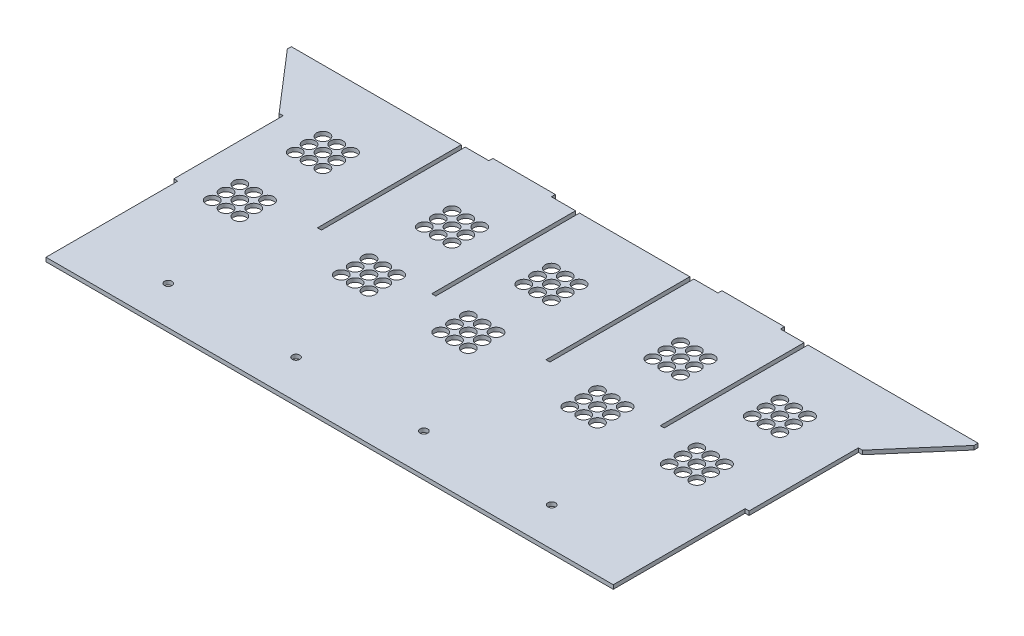
from build123d import *

# Parameters (mm, degrees)
SKETCH1_W                   = 457.2020066
SKETCH1_H                   = 3.175
BOSS_EXTRUDE1_DEPTH         = 242.425000036
SKETCH2_W                   = 3.175
SKETCH2_H                   = 114.3
CUT_EXTRUDE1_DEPTH          = 334.224218774
LPATTERN1_COUNT             = 4
LPATTERN1_PITCH             = 90.807
BOSS_EXTRUDE3_DEPTH         = 3.175
SKETCH5_W                   = 3.175
SKETCH5_H                   = 104.775
CUT_EXTRUDE2_DEPTH          = 3.175
SKETCH32_R                  = 3
CUT_EXTRUDE9_DEPTH          = 366.022293079
LPATTERN24_COUNT            = 4
LPATTERN24_PITCH            = 101.6
SKETCH34_R                  = 5
CUT_EXTRUDE10_DEPTH         = 366.022293079
LPATTERN25_COUNT            = 3
LPATTERN25_PITCH            = 11
LPATTERN26_COUNT            = 3
LPATTERN26_PITCH            = 11
LPATTERN26_COPY_1_SKETCH_R  = 5
LPATTERN26_COPY_1_DEPTH     = 366.022293079
LPATTERN26_COPY_2_SKETCH_R  = 5
LPATTERN26_COPY_2_DEPTH     = 366.022293079
LPATTERN26_COPY_3_SKETCH_R  = 5
LPATTERN26_COPY_3_DEPTH     = 366.022293079
LPATTERN26_COPY_4_SKETCH_R  = 5
LPATTERN26_COPY_4_DEPTH     = 366.022293079
LPATTERN27_COUNT            = 3
LPATTERN27_PITCH            = 181.6
LPATTERN27_COPY_1_SKETCH_R  = 5
LPATTERN27_COPY_1_DEPTH     = 366.022293079
LPATTERN27_COPY_2_SKETCH_R  = 5
LPATTERN27_COPY_2_DEPTH     = 366.022293079
LPATTERN27_COPY_3_SKETCH_R  = 5
LPATTERN27_COPY_3_DEPTH     = 366.022293079
LPATTERN27_COPY_4_SKETCH_R  = 5
LPATTERN27_COPY_4_DEPTH     = 366.022293079
LPATTERN27_COPY_5_SKETCH_R  = 5
LPATTERN27_COPY_5_DEPTH     = 366.022293079
LPATTERN27_COPY_6_SKETCH_R  = 5
LPATTERN27_COPY_6_DEPTH     = 366.022293079
LPATTERN27_COPY_7_SKETCH_R  = 5
LPATTERN27_COPY_7_DEPTH     = 366.022293079
LPATTERN27_COPY_8_SKETCH_R  = 5
LPATTERN27_COPY_8_DEPTH     = 366.022293079
LPATTERN27_COPY_9_SKETCH_R  = 5
LPATTERN27_COPY_9_DEPTH     = 366.022293079
LPATTERN27_COPY_10_SKETCH_R = 5
LPATTERN27_COPY_10_DEPTH    = 366.022293079
LPATTERN27_COPY_11_SKETCH_R = 5
LPATTERN27_COPY_11_DEPTH    = 366.022293079
LPATTERN27_COPY_12_SKETCH_R = 5
LPATTERN27_COPY_12_DEPTH    = 366.022293079
LPATTERN27_COPY_13_SKETCH_R = 5
LPATTERN27_COPY_13_DEPTH    = 366.022293079
LPATTERN27_COPY_14_SKETCH_R = 5
LPATTERN27_COPY_14_DEPTH    = 366.022293079
LPATTERN27_COPY_15_SKETCH_R = 5
LPATTERN27_COPY_15_DEPTH    = 366.022293079
LPATTERN27_COPY_16_SKETCH_R = 5
LPATTERN27_COPY_16_DEPTH    = 366.022293079
SKETCH35_R                  = 5
CUT_EXTRUDE11_DEPTH         = 366.022293079
LPATTERN28_COUNT            = 3
LPATTERN28_PITCH            = 11
LPATTERN29_COUNT            = 3
LPATTERN29_PITCH            = 11
LPATTERN29_COPY_1_SKETCH_R  = 5
LPATTERN29_COPY_1_DEPTH     = 366.022293079
LPATTERN29_COPY_2_SKETCH_R  = 5
LPATTERN29_COPY_2_DEPTH     = 366.022293079
LPATTERN29_COPY_3_SKETCH_R  = 5
LPATTERN29_COPY_3_DEPTH     = 366.022293079
LPATTERN29_COPY_4_SKETCH_R  = 5
LPATTERN29_COPY_4_DEPTH     = 366.022293079
LPATTERN30_COUNT            = 2
LPATTERN30_PITCH            = 181.6
LPATTERN30_COPY_1_SKETCH_R  = 5
LPATTERN30_COPY_1_DEPTH     = 366.022293079
LPATTERN30_COPY_2_SKETCH_R  = 5
LPATTERN30_COPY_2_DEPTH     = 366.022293079
LPATTERN30_COPY_3_SKETCH_R  = 5
LPATTERN30_COPY_3_DEPTH     = 366.022293079
LPATTERN30_COPY_4_SKETCH_R  = 5
LPATTERN30_COPY_4_DEPTH     = 366.022293079
LPATTERN30_COPY_5_SKETCH_R  = 5
LPATTERN30_COPY_5_DEPTH     = 366.022293079
LPATTERN30_COPY_6_SKETCH_R  = 5
LPATTERN30_COPY_6_DEPTH     = 366.022293079
LPATTERN30_COPY_7_SKETCH_R  = 5
LPATTERN30_COPY_7_DEPTH     = 366.022293079
LPATTERN30_COPY_8_SKETCH_R  = 5
LPATTERN30_COPY_8_DEPTH     = 366.022293079
SKETCH36_W                  = 49.658811606
SKETCH36_H                  = 3.175
BOSS_EXTRUDE4_DEPTH         = 3.175


with BuildPart() as part:
    # Sketch1 → Boss-Extrude1 (new body)
    with BuildSketch(Plane.XY):
        Rectangle(SKETCH1_W, SKETCH1_H)
    extrude(amount=BOSS_EXTRUDE1_DEPTH)

    # Sketch2 → Cut-Extrude1 (cut, through all)
    with BuildSketch(Plane(origin=(0, 1.5875, 0), x_dir=(1, 0, 0), z_dir=(0, 1, 0))):
        with Locations((136.2085033, -57.15)):
            Rectangle(SKETCH2_W, SKETCH2_H)
    cut_extrude1 = extrude(amount=-CUT_EXTRUDE1_DEPTH, mode=Mode.SUBTRACT)

    # LPattern1: Cut-Extrude1 ×4
    with Locations(*[(-i * LPATTERN1_PITCH, 0, 0) for i in range(1, LPATTERN1_COUNT)]):
        add(cut_extrude1, mode=Mode.SUBTRACT)

    # Sketch4 → Boss-Extrude3 (add)
    with BuildSketch(Plane.XZ.offset(1.5875)):
        Polygon((-228.6010033, 0), (-272.8760033, 0), (-272.8760033, 3.175), (-231.7760033, 50.8), (-228.6010033, 50.8), align=None)
    boss_extrude3 = extrude(amount=-BOSS_EXTRUDE3_DEPTH)

    # Mirror1: Boss-Extrude3 across plane
    add(boss_extrude3.mirror(Plane(origin=(0, 0, 0), x_dir=(0, 0, 1), z_dir=(1, 0, 0))))

    # Sketch5 → Cut-Extrude2 (cut)
    with BuildSketch(Plane.XZ.offset(1.5875)):
        with Locations((-227.0135033, 190.037500036)):
            Rectangle(SKETCH5_W, SKETCH5_H)
    cut_extrude2 = extrude(amount=-CUT_EXTRUDE2_DEPTH, mode=Mode.SUBTRACT)

    # Mirror2: Cut-Extrude2 across plane
    add(cut_extrude2.mirror(Plane(origin=(0, 0, 0), x_dir=(0, 0, 1), z_dir=(1, 0, 0))), mode=Mode.SUBTRACT)

    # Sketch32 → Cut-Extrude9 (cut, through all)
    with BuildSketch(Plane.XZ.offset(1.5875)):
        with Locations(Location((145.971441249, 211.879970101, 0), (0, 0, 270))):
            Circle(SKETCH32_R)
    cut_extrude9 = extrude(amount=-CUT_EXTRUDE9_DEPTH, mode=Mode.SUBTRACT)

    # LPattern24: Cut-Extrude9 ×4
    with Locations(*[(-i * LPATTERN24_PITCH, 0, 0) for i in range(1, LPATTERN24_COUNT)]):
        add(cut_extrude9, mode=Mode.SUBTRACT)

    # Sketch34 → Cut-Extrude10 (cut, through all)
    with BuildSketch(Plane(origin=(0, 1.5875, 0), x_dir=(1, 0, 0), z_dir=(0, 1, 0))):
        with Locations(Location((-198.515375, -49.256662939, 0), (0, 0, 270))):
            Circle(SKETCH34_R)
        with Locations(Location((-198.515375, -115.256662939, 0), (0, 0, 270))):
            Circle(SKETCH34_R)
    cut_extrude10 = extrude(amount=-CUT_EXTRUDE10_DEPTH, mode=Mode.SUBTRACT)

    # LPattern25: Cut-Extrude10 ×3
    with Locations(*[(i * LPATTERN25_PITCH, 0, 0) for i in range(1, LPATTERN25_COUNT)]):
        add(cut_extrude10, mode=Mode.SUBTRACT)

    # LPattern26: Cut-Extrude10 ×3
    with Locations(*[(0, 0, i * LPATTERN26_PITCH) for i in range(1, LPATTERN26_COUNT)]):
        add(cut_extrude10, mode=Mode.SUBTRACT)

    # LPattern26 copy 1 sketch → LPattern26 copy 1 (cut, through all)
    with BuildSketch(Plane(origin=(11, 1.5875, 11), x_dir=(1, 0, 0), z_dir=(0, 1, 0))):
        with Locations(Location((-198.515375, -49.256662939, 0), (0, 0, 270))):
            Circle(LPATTERN26_COPY_1_SKETCH_R)
        with Locations(Location((-198.515375, -115.256662939, 0), (0, 0, 270))):
            Circle(LPATTERN26_COPY_1_SKETCH_R)
    extrude(amount=-LPATTERN26_COPY_1_DEPTH, mode=Mode.SUBTRACT)

    # LPattern26 copy 2 sketch → LPattern26 copy 2 (cut, through all)
    with BuildSketch(Plane(origin=(11, 1.5875, 22), x_dir=(1, 0, 0), z_dir=(0, 1, 0))):
        with Locations(Location((-198.515375, -49.256662939, 0), (0, 0, 270))):
            Circle(LPATTERN26_COPY_2_SKETCH_R)
        with Locations(Location((-198.515375, -115.256662939, 0), (0, 0, 270))):
            Circle(LPATTERN26_COPY_2_SKETCH_R)
    extrude(amount=-LPATTERN26_COPY_2_DEPTH, mode=Mode.SUBTRACT)

    # LPattern26 copy 3 sketch → LPattern26 copy 3 (cut, through all)
    with BuildSketch(Plane(origin=(22, 1.5875, 11), x_dir=(1, 0, 0), z_dir=(0, 1, 0))):
        with Locations(Location((-198.515375, -49.256662939, 0), (0, 0, 270))):
            Circle(LPATTERN26_COPY_3_SKETCH_R)
        with Locations(Location((-198.515375, -115.256662939, 0), (0, 0, 270))):
            Circle(LPATTERN26_COPY_3_SKETCH_R)
    extrude(amount=-LPATTERN26_COPY_3_DEPTH, mode=Mode.SUBTRACT)

    # LPattern26 copy 4 sketch → LPattern26 copy 4 (cut, through all)
    with BuildSketch(Plane(origin=(22, 1.5875, 22), x_dir=(1, 0, 0), z_dir=(0, 1, 0))):
        with Locations(Location((-198.515375, -49.256662939, 0), (0, 0, 270))):
            Circle(LPATTERN26_COPY_4_SKETCH_R)
        with Locations(Location((-198.515375, -115.256662939, 0), (0, 0, 270))):
            Circle(LPATTERN26_COPY_4_SKETCH_R)
    extrude(amount=-LPATTERN26_COPY_4_DEPTH, mode=Mode.SUBTRACT)

    # LPattern27: Cut-Extrude10 ×3
    with Locations(*[(i * LPATTERN27_PITCH, 0, 0) for i in range(1, LPATTERN27_COUNT)]):
        add(cut_extrude10, mode=Mode.SUBTRACT)

    # LPattern27 copy 1 sketch → LPattern27 copy 1 (cut, through all)
    with BuildSketch(Plane(origin=(192.6, 1.5875, 0), x_dir=(1, 0, 0), z_dir=(0, 1, 0))):
        with Locations(Location((-198.515375, -49.256662939, 0), (0, 0, 270))):
            Circle(LPATTERN27_COPY_1_SKETCH_R)
        with Locations(Location((-198.515375, -115.256662939, 0), (0, 0, 270))):
            Circle(LPATTERN27_COPY_1_SKETCH_R)
    extrude(amount=-LPATTERN27_COPY_1_DEPTH, mode=Mode.SUBTRACT)

    # LPattern27 copy 2 sketch → LPattern27 copy 2 (cut, through all)
    with BuildSketch(Plane(origin=(374.2, 1.5875, 0), x_dir=(1, 0, 0), z_dir=(0, 1, 0))):
        with Locations(Location((-198.515375, -49.256662939, 0), (0, 0, 270))):
            Circle(LPATTERN27_COPY_2_SKETCH_R)
        with Locations(Location((-198.515375, -115.256662939, 0), (0, 0, 270))):
            Circle(LPATTERN27_COPY_2_SKETCH_R)
    extrude(amount=-LPATTERN27_COPY_2_DEPTH, mode=Mode.SUBTRACT)

    # LPattern27 copy 3 sketch → LPattern27 copy 3 (cut, through all)
    with BuildSketch(Plane(origin=(203.6, 1.5875, 0), x_dir=(1, 0, 0), z_dir=(0, 1, 0))):
        with Locations(Location((-198.515375, -49.256662939, 0), (0, 0, 270))):
            Circle(LPATTERN27_COPY_3_SKETCH_R)
        with Locations(Location((-198.515375, -115.256662939, 0), (0, 0, 270))):
            Circle(LPATTERN27_COPY_3_SKETCH_R)
    extrude(amount=-LPATTERN27_COPY_3_DEPTH, mode=Mode.SUBTRACT)

    # LPattern27 copy 4 sketch → LPattern27 copy 4 (cut, through all)
    with BuildSketch(Plane(origin=(385.2, 1.5875, 0), x_dir=(1, 0, 0), z_dir=(0, 1, 0))):
        with Locations(Location((-198.515375, -49.256662939, 0), (0, 0, 270))):
            Circle(LPATTERN27_COPY_4_SKETCH_R)
        with Locations(Location((-198.515375, -115.256662939, 0), (0, 0, 270))):
            Circle(LPATTERN27_COPY_4_SKETCH_R)
    extrude(amount=-LPATTERN27_COPY_4_DEPTH, mode=Mode.SUBTRACT)

    # LPattern27 copy 5 sketch → LPattern27 copy 5 (cut, through all)
    with BuildSketch(Plane(origin=(181.6, 1.5875, 11), x_dir=(1, 0, 0), z_dir=(0, 1, 0))):
        with Locations(Location((-198.515375, -49.256662939, 0), (0, 0, 270))):
            Circle(LPATTERN27_COPY_5_SKETCH_R)
        with Locations(Location((-198.515375, -115.256662939, 0), (0, 0, 270))):
            Circle(LPATTERN27_COPY_5_SKETCH_R)
    extrude(amount=-LPATTERN27_COPY_5_DEPTH, mode=Mode.SUBTRACT)

    # LPattern27 copy 6 sketch → LPattern27 copy 6 (cut, through all)
    with BuildSketch(Plane(origin=(363.2, 1.5875, 11), x_dir=(1, 0, 0), z_dir=(0, 1, 0))):
        with Locations(Location((-198.515375, -49.256662939, 0), (0, 0, 270))):
            Circle(LPATTERN27_COPY_6_SKETCH_R)
        with Locations(Location((-198.515375, -115.256662939, 0), (0, 0, 270))):
            Circle(LPATTERN27_COPY_6_SKETCH_R)
    extrude(amount=-LPATTERN27_COPY_6_DEPTH, mode=Mode.SUBTRACT)

    # LPattern27 copy 7 sketch → LPattern27 copy 7 (cut, through all)
    with BuildSketch(Plane(origin=(181.6, 1.5875, 22), x_dir=(1, 0, 0), z_dir=(0, 1, 0))):
        with Locations(Location((-198.515375, -49.256662939, 0), (0, 0, 270))):
            Circle(LPATTERN27_COPY_7_SKETCH_R)
        with Locations(Location((-198.515375, -115.256662939, 0), (0, 0, 270))):
            Circle(LPATTERN27_COPY_7_SKETCH_R)
    extrude(amount=-LPATTERN27_COPY_7_DEPTH, mode=Mode.SUBTRACT)

    # LPattern27 copy 8 sketch → LPattern27 copy 8 (cut, through all)
    with BuildSketch(Plane(origin=(363.2, 1.5875, 22), x_dir=(1, 0, 0), z_dir=(0, 1, 0))):
        with Locations(Location((-198.515375, -49.256662939, 0), (0, 0, 270))):
            Circle(LPATTERN27_COPY_8_SKETCH_R)
        with Locations(Location((-198.515375, -115.256662939, 0), (0, 0, 270))):
            Circle(LPATTERN27_COPY_8_SKETCH_R)
    extrude(amount=-LPATTERN27_COPY_8_DEPTH, mode=Mode.SUBTRACT)

    # LPattern27 copy 9 sketch → LPattern27 copy 9 (cut, through all)
    with BuildSketch(Plane(origin=(192.6, 1.5875, 11), x_dir=(1, 0, 0), z_dir=(0, 1, 0))):
        with Locations(Location((-198.515375, -49.256662939, 0), (0, 0, 270))):
            Circle(LPATTERN27_COPY_9_SKETCH_R)
        with Locations(Location((-198.515375, -115.256662939, 0), (0, 0, 270))):
            Circle(LPATTERN27_COPY_9_SKETCH_R)
    extrude(amount=-LPATTERN27_COPY_9_DEPTH, mode=Mode.SUBTRACT)

    # LPattern27 copy 10 sketch → LPattern27 copy 10 (cut, through all)
    with BuildSketch(Plane(origin=(374.2, 1.5875, 11), x_dir=(1, 0, 0), z_dir=(0, 1, 0))):
        with Locations(Location((-198.515375, -49.256662939, 0), (0, 0, 270))):
            Circle(LPATTERN27_COPY_10_SKETCH_R)
        with Locations(Location((-198.515375, -115.256662939, 0), (0, 0, 270))):
            Circle(LPATTERN27_COPY_10_SKETCH_R)
    extrude(amount=-LPATTERN27_COPY_10_DEPTH, mode=Mode.SUBTRACT)

    # LPattern27 copy 11 sketch → LPattern27 copy 11 (cut, through all)
    with BuildSketch(Plane(origin=(192.6, 1.5875, 22), x_dir=(1, 0, 0), z_dir=(0, 1, 0))):
        with Locations(Location((-198.515375, -49.256662939, 0), (0, 0, 270))):
            Circle(LPATTERN27_COPY_11_SKETCH_R)
        with Locations(Location((-198.515375, -115.256662939, 0), (0, 0, 270))):
            Circle(LPATTERN27_COPY_11_SKETCH_R)
    extrude(amount=-LPATTERN27_COPY_11_DEPTH, mode=Mode.SUBTRACT)

    # LPattern27 copy 12 sketch → LPattern27 copy 12 (cut, through all)
    with BuildSketch(Plane(origin=(374.2, 1.5875, 22), x_dir=(1, 0, 0), z_dir=(0, 1, 0))):
        with Locations(Location((-198.515375, -49.256662939, 0), (0, 0, 270))):
            Circle(LPATTERN27_COPY_12_SKETCH_R)
        with Locations(Location((-198.515375, -115.256662939, 0), (0, 0, 270))):
            Circle(LPATTERN27_COPY_12_SKETCH_R)
    extrude(amount=-LPATTERN27_COPY_12_DEPTH, mode=Mode.SUBTRACT)

    # LPattern27 copy 13 sketch → LPattern27 copy 13 (cut, through all)
    with BuildSketch(Plane(origin=(203.6, 1.5875, 11), x_dir=(1, 0, 0), z_dir=(0, 1, 0))):
        with Locations(Location((-198.515375, -49.256662939, 0), (0, 0, 270))):
            Circle(LPATTERN27_COPY_13_SKETCH_R)
        with Locations(Location((-198.515375, -115.256662939, 0), (0, 0, 270))):
            Circle(LPATTERN27_COPY_13_SKETCH_R)
    extrude(amount=-LPATTERN27_COPY_13_DEPTH, mode=Mode.SUBTRACT)

    # LPattern27 copy 14 sketch → LPattern27 copy 14 (cut, through all)
    with BuildSketch(Plane(origin=(385.2, 1.5875, 11), x_dir=(1, 0, 0), z_dir=(0, 1, 0))):
        with Locations(Location((-198.515375, -49.256662939, 0), (0, 0, 270))):
            Circle(LPATTERN27_COPY_14_SKETCH_R)
        with Locations(Location((-198.515375, -115.256662939, 0), (0, 0, 270))):
            Circle(LPATTERN27_COPY_14_SKETCH_R)
    extrude(amount=-LPATTERN27_COPY_14_DEPTH, mode=Mode.SUBTRACT)

    # LPattern27 copy 15 sketch → LPattern27 copy 15 (cut, through all)
    with BuildSketch(Plane(origin=(203.6, 1.5875, 22), x_dir=(1, 0, 0), z_dir=(0, 1, 0))):
        with Locations(Location((-198.515375, -49.256662939, 0), (0, 0, 270))):
            Circle(LPATTERN27_COPY_15_SKETCH_R)
        with Locations(Location((-198.515375, -115.256662939, 0), (0, 0, 270))):
            Circle(LPATTERN27_COPY_15_SKETCH_R)
    extrude(amount=-LPATTERN27_COPY_15_DEPTH, mode=Mode.SUBTRACT)

    # LPattern27 copy 16 sketch → LPattern27 copy 16 (cut, through all)
    with BuildSketch(Plane(origin=(385.2, 1.5875, 22), x_dir=(1, 0, 0), z_dir=(0, 1, 0))):
        with Locations(Location((-198.515375, -49.256662939, 0), (0, 0, 270))):
            Circle(LPATTERN27_COPY_16_SKETCH_R)
        with Locations(Location((-198.515375, -115.256662939, 0), (0, 0, 270))):
            Circle(LPATTERN27_COPY_16_SKETCH_R)
    extrude(amount=-LPATTERN27_COPY_16_DEPTH, mode=Mode.SUBTRACT)

    # Sketch35 → Cut-Extrude11 (cut, through all)
    with BuildSketch(Plane(origin=(0, 1.5875, 0), x_dir=(1, 0, 0), z_dir=(0, 1, 0))):
        with Locations(Location((107.701374992, -115.256662939, 0), (0, 0, 270))):
            Circle(SKETCH35_R)
        with Locations(Location((107.701374992, -49.256662939, 0), (0, 0, 270))):
            Circle(SKETCH35_R)
    cut_extrude11 = extrude(amount=-CUT_EXTRUDE11_DEPTH, mode=Mode.SUBTRACT)

    # LPattern28: Cut-Extrude11 ×3
    with Locations(*[(-i * LPATTERN28_PITCH, 0, 0) for i in range(1, LPATTERN28_COUNT)]):
        add(cut_extrude11, mode=Mode.SUBTRACT)

    # LPattern29: Cut-Extrude11 ×3
    with Locations(*[(0, 0, i * LPATTERN29_PITCH) for i in range(1, LPATTERN29_COUNT)]):
        add(cut_extrude11, mode=Mode.SUBTRACT)

    # LPattern29 copy 1 sketch → LPattern29 copy 1 (cut, through all)
    with BuildSketch(Plane(origin=(-11, 1.5875, 11), x_dir=(1, 0, 0), z_dir=(0, 1, 0))):
        with Locations(Location((107.701374992, -115.256662939, 0), (0, 0, 270))):
            Circle(LPATTERN29_COPY_1_SKETCH_R)
        with Locations(Location((107.701374992, -49.256662939, 0), (0, 0, 270))):
            Circle(LPATTERN29_COPY_1_SKETCH_R)
    extrude(amount=-LPATTERN29_COPY_1_DEPTH, mode=Mode.SUBTRACT)

    # LPattern29 copy 2 sketch → LPattern29 copy 2 (cut, through all)
    with BuildSketch(Plane(origin=(-11, 1.5875, 22), x_dir=(1, 0, 0), z_dir=(0, 1, 0))):
        with Locations(Location((107.701374992, -115.256662939, 0), (0, 0, 270))):
            Circle(LPATTERN29_COPY_2_SKETCH_R)
        with Locations(Location((107.701374992, -49.256662939, 0), (0, 0, 270))):
            Circle(LPATTERN29_COPY_2_SKETCH_R)
    extrude(amount=-LPATTERN29_COPY_2_DEPTH, mode=Mode.SUBTRACT)

    # LPattern29 copy 3 sketch → LPattern29 copy 3 (cut, through all)
    with BuildSketch(Plane(origin=(-22, 1.5875, 11), x_dir=(1, 0, 0), z_dir=(0, 1, 0))):
        with Locations(Location((107.701374992, -115.256662939, 0), (0, 0, 270))):
            Circle(LPATTERN29_COPY_3_SKETCH_R)
        with Locations(Location((107.701374992, -49.256662939, 0), (0, 0, 270))):
            Circle(LPATTERN29_COPY_3_SKETCH_R)
    extrude(amount=-LPATTERN29_COPY_3_DEPTH, mode=Mode.SUBTRACT)

    # LPattern29 copy 4 sketch → LPattern29 copy 4 (cut, through all)
    with BuildSketch(Plane(origin=(-22, 1.5875, 22), x_dir=(1, 0, 0), z_dir=(0, 1, 0))):
        with Locations(Location((107.701374992, -115.256662939, 0), (0, 0, 270))):
            Circle(LPATTERN29_COPY_4_SKETCH_R)
        with Locations(Location((107.701374992, -49.256662939, 0), (0, 0, 270))):
            Circle(LPATTERN29_COPY_4_SKETCH_R)
    extrude(amount=-LPATTERN29_COPY_4_DEPTH, mode=Mode.SUBTRACT)

    # LPattern30: Cut-Extrude11 ×2
    with Locations(*[(-i * LPATTERN30_PITCH, 0, 0) for i in range(1, LPATTERN30_COUNT)]):
        add(cut_extrude11, mode=Mode.SUBTRACT)

    # LPattern30 copy 1 sketch → LPattern30 copy 1 (cut, through all)
    with BuildSketch(Plane(origin=(-192.6, 1.5875, 0), x_dir=(1, 0, 0), z_dir=(0, 1, 0))):
        with Locations(Location((107.701374992, -115.256662939, 0), (0, 0, 270))):
            Circle(LPATTERN30_COPY_1_SKETCH_R)
        with Locations(Location((107.701374992, -49.256662939, 0), (0, 0, 270))):
            Circle(LPATTERN30_COPY_1_SKETCH_R)
    extrude(amount=-LPATTERN30_COPY_1_DEPTH, mode=Mode.SUBTRACT)

    # LPattern30 copy 2 sketch → LPattern30 copy 2 (cut, through all)
    with BuildSketch(Plane(origin=(-203.6, 1.5875, 0), x_dir=(1, 0, 0), z_dir=(0, 1, 0))):
        with Locations(Location((107.701374992, -115.256662939, 0), (0, 0, 270))):
            Circle(LPATTERN30_COPY_2_SKETCH_R)
        with Locations(Location((107.701374992, -49.256662939, 0), (0, 0, 270))):
            Circle(LPATTERN30_COPY_2_SKETCH_R)
    extrude(amount=-LPATTERN30_COPY_2_DEPTH, mode=Mode.SUBTRACT)

    # LPattern30 copy 3 sketch → LPattern30 copy 3 (cut, through all)
    with BuildSketch(Plane(origin=(-181.6, 1.5875, 11), x_dir=(1, 0, 0), z_dir=(0, 1, 0))):
        with Locations(Location((107.701374992, -115.256662939, 0), (0, 0, 270))):
            Circle(LPATTERN30_COPY_3_SKETCH_R)
        with Locations(Location((107.701374992, -49.256662939, 0), (0, 0, 270))):
            Circle(LPATTERN30_COPY_3_SKETCH_R)
    extrude(amount=-LPATTERN30_COPY_3_DEPTH, mode=Mode.SUBTRACT)

    # LPattern30 copy 4 sketch → LPattern30 copy 4 (cut, through all)
    with BuildSketch(Plane(origin=(-181.6, 1.5875, 22), x_dir=(1, 0, 0), z_dir=(0, 1, 0))):
        with Locations(Location((107.701374992, -115.256662939, 0), (0, 0, 270))):
            Circle(LPATTERN30_COPY_4_SKETCH_R)
        with Locations(Location((107.701374992, -49.256662939, 0), (0, 0, 270))):
            Circle(LPATTERN30_COPY_4_SKETCH_R)
    extrude(amount=-LPATTERN30_COPY_4_DEPTH, mode=Mode.SUBTRACT)

    # LPattern30 copy 5 sketch → LPattern30 copy 5 (cut, through all)
    with BuildSketch(Plane(origin=(-192.6, 1.5875, 11), x_dir=(1, 0, 0), z_dir=(0, 1, 0))):
        with Locations(Location((107.701374992, -115.256662939, 0), (0, 0, 270))):
            Circle(LPATTERN30_COPY_5_SKETCH_R)
        with Locations(Location((107.701374992, -49.256662939, 0), (0, 0, 270))):
            Circle(LPATTERN30_COPY_5_SKETCH_R)
    extrude(amount=-LPATTERN30_COPY_5_DEPTH, mode=Mode.SUBTRACT)

    # LPattern30 copy 6 sketch → LPattern30 copy 6 (cut, through all)
    with BuildSketch(Plane(origin=(-192.6, 1.5875, 22), x_dir=(1, 0, 0), z_dir=(0, 1, 0))):
        with Locations(Location((107.701374992, -115.256662939, 0), (0, 0, 270))):
            Circle(LPATTERN30_COPY_6_SKETCH_R)
        with Locations(Location((107.701374992, -49.256662939, 0), (0, 0, 270))):
            Circle(LPATTERN30_COPY_6_SKETCH_R)
    extrude(amount=-LPATTERN30_COPY_6_DEPTH, mode=Mode.SUBTRACT)

    # LPattern30 copy 7 sketch → LPattern30 copy 7 (cut, through all)
    with BuildSketch(Plane(origin=(-203.6, 1.5875, 11), x_dir=(1, 0, 0), z_dir=(0, 1, 0))):
        with Locations(Location((107.701374992, -115.256662939, 0), (0, 0, 270))):
            Circle(LPATTERN30_COPY_7_SKETCH_R)
        with Locations(Location((107.701374992, -49.256662939, 0), (0, 0, 270))):
            Circle(LPATTERN30_COPY_7_SKETCH_R)
    extrude(amount=-LPATTERN30_COPY_7_DEPTH, mode=Mode.SUBTRACT)

    # LPattern30 copy 8 sketch → LPattern30 copy 8 (cut, through all)
    with BuildSketch(Plane(origin=(-203.6, 1.5875, 22), x_dir=(1, 0, 0), z_dir=(0, 1, 0))):
        with Locations(Location((107.701374992, -115.256662939, 0), (0, 0, 270))):
            Circle(LPATTERN30_COPY_8_SKETCH_R)
        with Locations(Location((107.701374992, -49.256662939, 0), (0, 0, 270))):
            Circle(LPATTERN30_COPY_8_SKETCH_R)
    extrude(amount=-LPATTERN30_COPY_8_DEPTH, mode=Mode.SUBTRACT)

    # Sketch36 → Boss-Extrude4 (add)
    with BuildSketch(Plane(origin=(0, 0, 0), x_dir=(-1, 0, 0), z_dir=(0, 0, -1))):
        with Locations((91.020094169, 0)):
            Rectangle(SKETCH36_W, SKETCH36_H)
        with Locations((-91.020094169, 0)):
            Rectangle(SKETCH36_W, SKETCH36_H)
    extrude(amount=BOSS_EXTRUDE4_DEPTH)


solid = part.part
